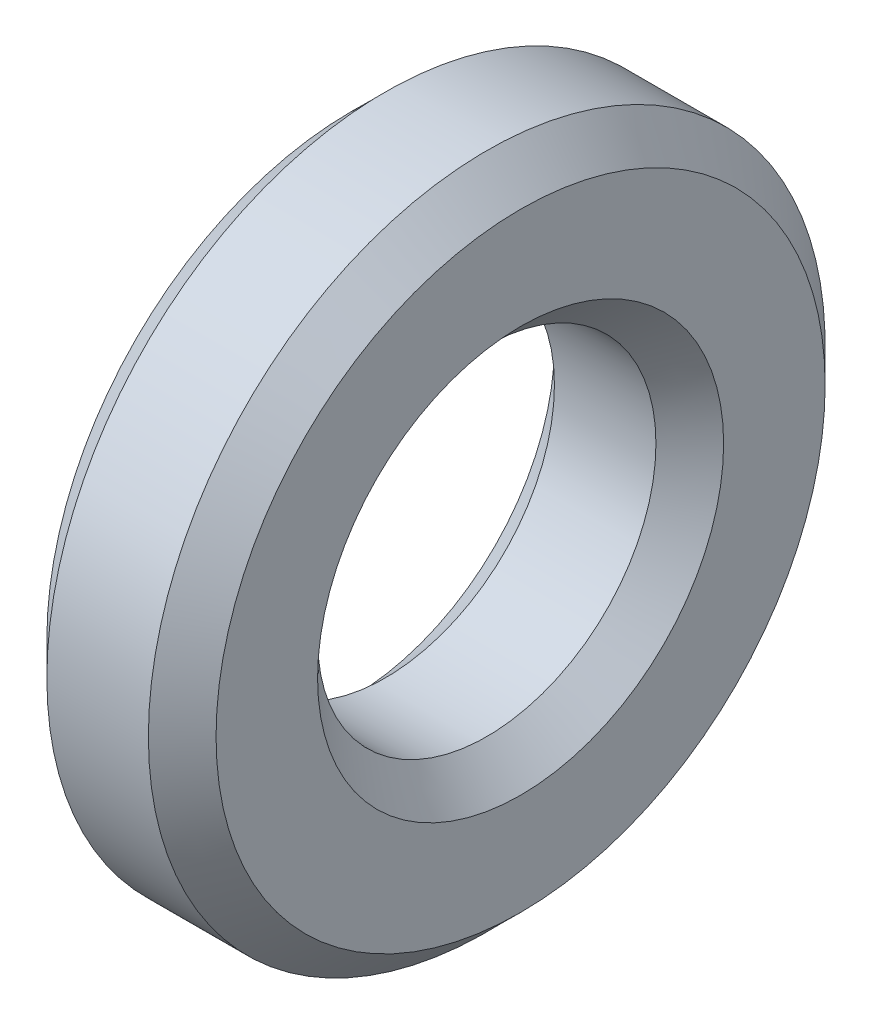
from build123d import *

# Parameters (mm, degrees)
SKETCH1_W     = 1
SKETCH1_H     = 1
CHAMFER1_SIZE = 0.2


with BuildPart() as part:
    # Sketch1 → Revolve1 (revolve)
    with BuildSketch(Plane.XY, mode=Mode.PRIVATE) as revolve1_sk:
        with Locations((0.5, 1.5)):
            Rectangle(SKETCH1_W, SKETCH1_H)
    revolve(revolve1_sk.sketch.rotate(Axis((0, 0, 0), (1, 0, 0)), 90), axis=Axis((0, 0, 0), (1, 0, 0)))

    # Chamfer1
    chamfer1_edges = [part.edges().sort_by_distance(p)[0] for p in [
        (0, 0, -1),
        (1, 0, -1),
        (1, 0, -2),
        (0, 0, -2),
    ]]
    chamfer(chamfer1_edges, length=CHAMFER1_SIZE)


solid = part.part
